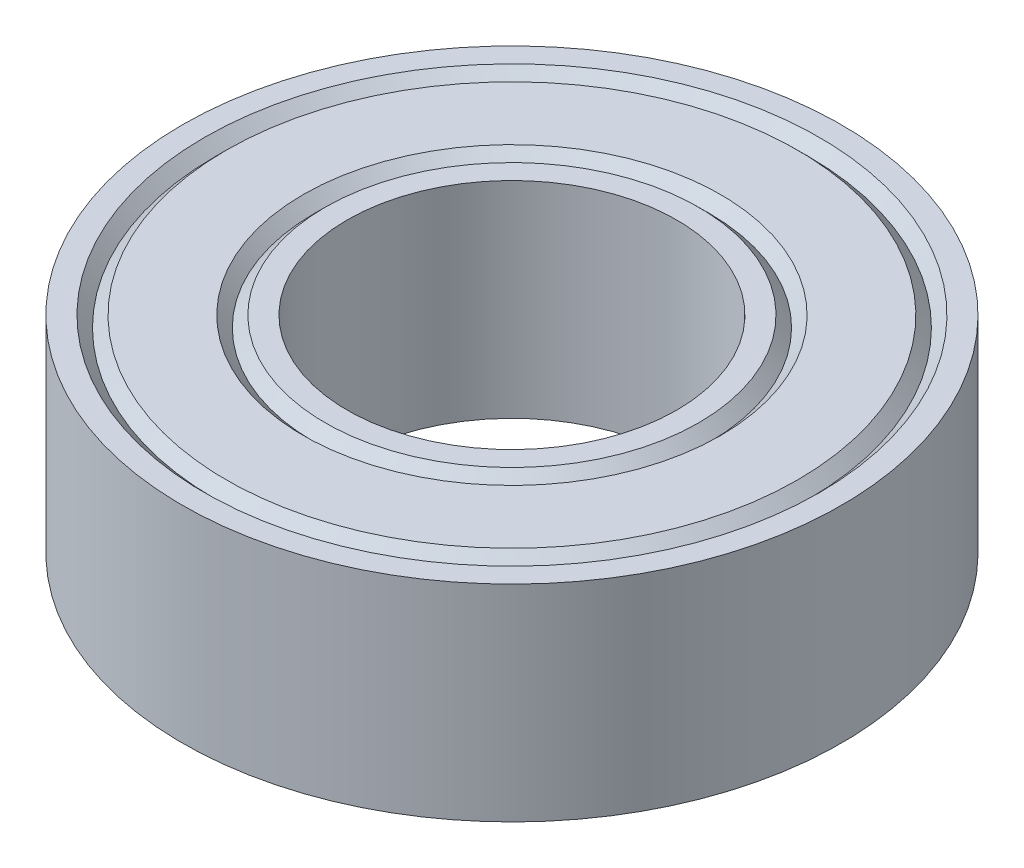
from build123d import *


with BuildPart() as part:
    # Sketch1 → Revolve1 (revolve)
    with BuildSketch(Plane.XY):
        Polygon((-4, 2.5), (-4.533333333, 2.5), (-4.8, 2.233333333), (-5.066666667, 2.5), (-6.933333333, 2.5), (-7.2, 2.233333333), (-7.466666667, 2.5), (-8, 2.5), (-8, -2.5), (-7.466666667, -2.5), (-7.2, -2.233333333), (-6.933333333, -2.5), (-5.066666667, -2.5), (-4.8, -2.233333333), (-4.533333333, -2.5), (-4, -2.5), align=None)
    revolve(axis=Axis((0, 2.5, 0), (0, -1, 0)))


solid = part.part
